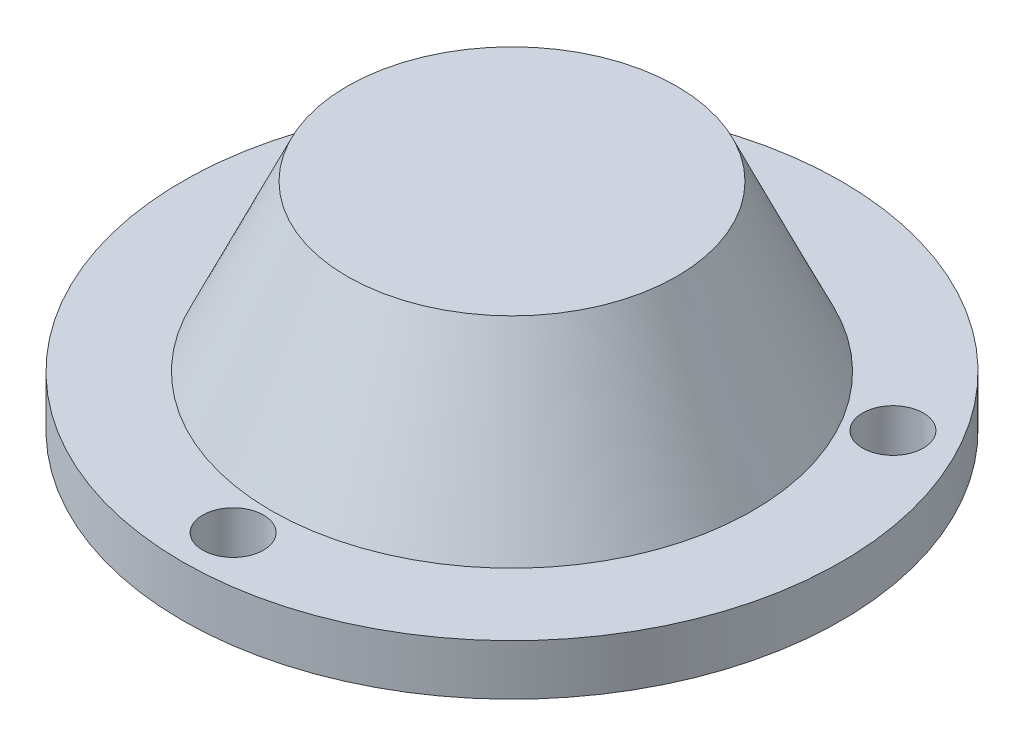
from build123d import *

# Parameters (mm, degrees)
FILLET1_R          = 3
SKETCH2_R          = 1.2
CUT_EXTRUDE1_DEPTH = 10


with BuildPart() as part:
    # Sketch1 one side → Revolve1 (revolve)
    with BuildSketch(Plane.XY, mode=Mode.PRIVATE) as revolve1_sk:
        with BuildLine():
            Line((6.5, 8.5), (0, 8.5))
            Line((0, 8.5), (0, -7))
            ThreePointArc((0, -7), (3.456192986, -5.967326651), (5.779332516, -3.207850808))
            Line((5.779332516, -3.207850808), (5.996722799, -3.207850808))
            ThreePointArc((5.996722799, -3.207850808), (6.15577987, -1.598658708), (5.9126982, 0))
            Line((5.9126982, 0), (13, 0))
            Line((13, 0), (13, 2))
            Line((13, 2), (9.5, 2))
            Line((9.5, 2), (6.5, 8.5))
        make_face()
    revolve(revolve1_sk.sketch.rotate(Axis((0, 8.5, 0), (0, -1, 0)), 90), axis=Axis((0, 8.5, 0), (0, -1, 0)))

    # Fillet1
    fillet1_edges = [part.edges().sort_by_distance(p)[0] for p in [
        (0, 0, -5.9126982),
    ]]
    fillet(fillet1_edges, radius=FILLET1_R)

    # Sketch2 → Cut-Extrude1 (cut)
    with BuildSketch(Plane.XZ):
        with Locations(Location((0, 11, 0), (0, 0, 270))):
            Circle(SKETCH2_R)
        with Locations(Location((9.526279442, -5.5, 0), (0, 0, 270))):
            Circle(SKETCH2_R)
        with Locations(Location((-9.526279442, -5.5, 0), (0, 0, 270))):
            Circle(SKETCH2_R)
    extrude(amount=-CUT_EXTRUDE1_DEPTH, mode=Mode.SUBTRACT)


solid = part.part
